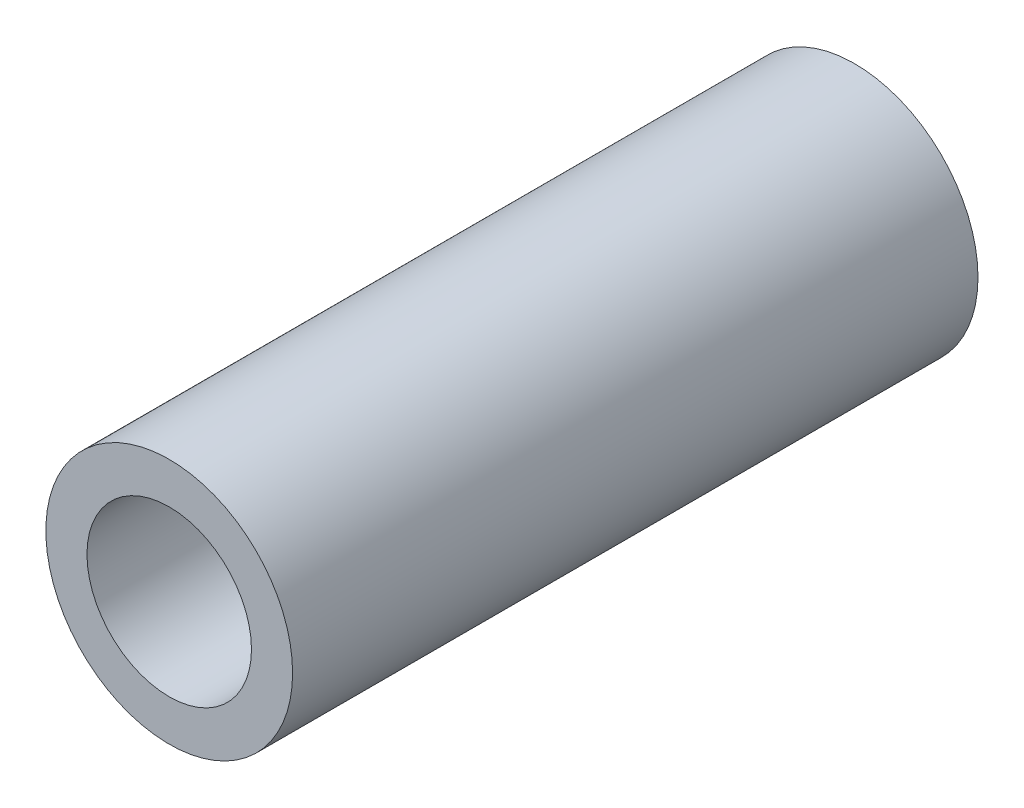
from build123d import *

# Parameters (mm, degrees)
SKETCH_1_R   = 9
SLEEVE_DEPTH = 50
SKETCH_2_R   = 6
BORE_DEPTH   = 52.594573358


with BuildPart() as part:
    # 草图1 → Sleeve (new body)
    with BuildSketch(Plane.XY):
        Circle(SKETCH_1_R)
    extrude(amount=SLEEVE_DEPTH)

    # 草图2 → Bore (cut, through all)
    with BuildSketch(Plane.XY.offset(50)):
        Circle(SKETCH_2_R)
    extrude(amount=-BORE_DEPTH, mode=Mode.SUBTRACT)


solid = part.part
